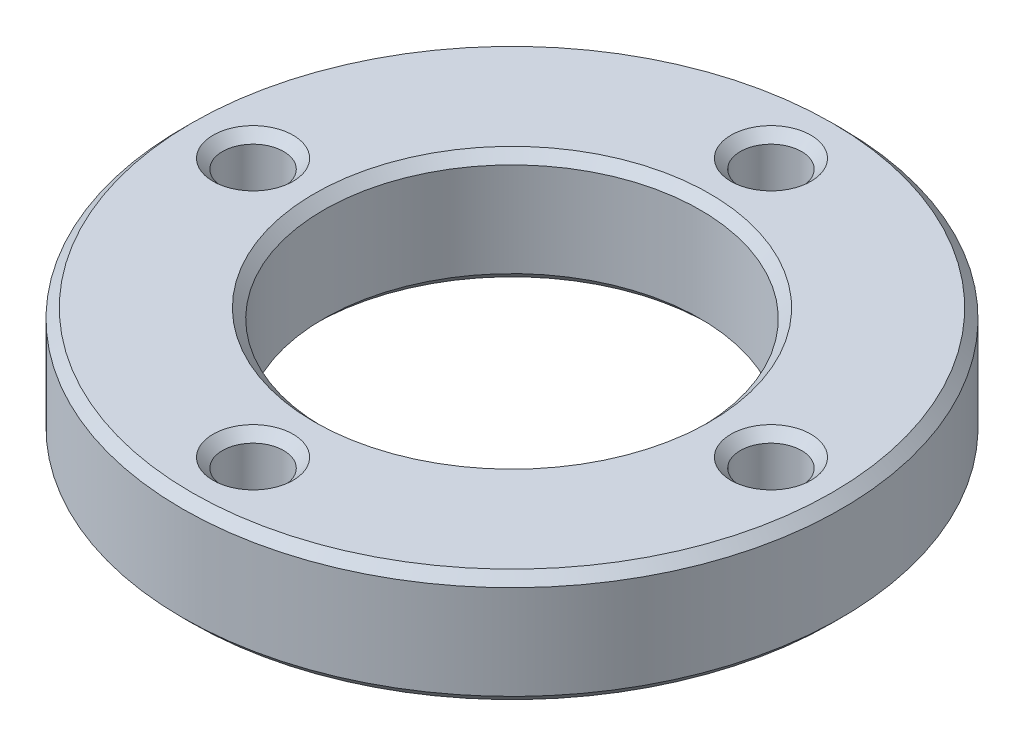
from build123d import *

# Parameters (mm, degrees)
SKETCH1_R           = 35
SKETCH1_R_2         = 20
SKETCH1_R_3         = 3.25
BOSS_EXTRUDE1_DEPTH = 12
CHAMFER1_SIZE       = 1


with BuildPart() as part:
    # Sketch1 → Boss-Extrude1 (new body)
    with BuildSketch(Plane(origin=(0, 0, 0), x_dir=(1, 0, 0), z_dir=(0, 1, 0))):
        with Locations(Location((0, 0, 0), (0, 0, 270))):
            Circle(SKETCH1_R)
        with Locations(Location((0, 0, 0), (0, 0, 270))):
            Circle(SKETCH1_R_2, mode=Mode.SUBTRACT)
        with Locations(Location((27.5, 0, 0), (0, 0, 270))):
            Circle(SKETCH1_R_3, mode=Mode.SUBTRACT)
        with Locations(Location((0, -27.5, 0), (0, 0, 270))):
            Circle(SKETCH1_R_3, mode=Mode.SUBTRACT)
        with Locations(Location((-27.5, 0, 0), (0, 0, 270))):
            Circle(SKETCH1_R_3, mode=Mode.SUBTRACT)
        with Locations(Location((0, 27.5, 0), (0, 0, 270))):
            Circle(SKETCH1_R_3, mode=Mode.SUBTRACT)
    extrude(amount=BOSS_EXTRUDE1_DEPTH)

    # Chamfer1
    chamfer1_edges = [part.edges().sort_by_distance(p)[0] for p in [
        (0, 0, 24.25),
        (0, 12, 24.25),
        (-27.5, 0, -3.25),
        (-27.5, 12, -3.25),
        (0, 0, -35),
        (0, 0, -30.75),
        (0, 12, -30.75),
        (0, 12, -35),
        (0, 0, -20),
        (0, 12, -20),
        (27.5, 0, -3.25),
        (27.5, 12, -3.25),
    ]]
    chamfer(chamfer1_edges, length=CHAMFER1_SIZE)


solid = part.part
